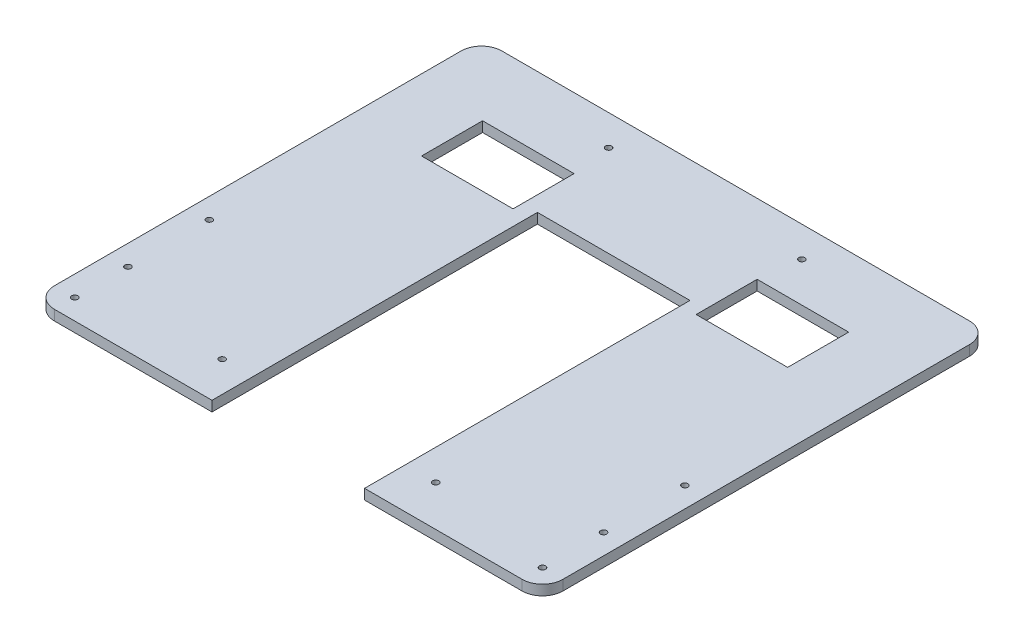
from build123d import *

# Parameters (mm, degrees)
EXTRUDE_1_DEPTH      = 5
SKETCH_4_W           = 45
SKETCH_4_H           = 30
CUT_EXTRUDE_3_DEPTH  = 5
SKETCH_5_W           = 75
SKETCH_5_H           = 160
CUT_EXTRUDE_4_DEPTH  = 5
CUT_EXTRUDE_5_REACH  = 335.054
SKETCH_6_R           = 1.5
CUT_EXTRUDE_9_REACH  = 335.054
SKETCH_9_R           = 1.5
SKETCH_11_R          = 1.5
CUT_EXTRUDE_10_DEPTH = 5


with BuildPart() as part:
    # 草图1 → 凸台-拉伸1 (new body)
    with BuildSketch(Plane(origin=(0, 0, 0), x_dir=(1, 0, 0), z_dir=(0, 1, 0))):
        with BuildLine():
            Line((10, 0), (240, 0))
            ThreePointArc((240, 0), (247.071067812, -2.928932188), (250, -10))
            Line((250, -10), (250, -210))
            ThreePointArc((250, -210), (247.071067812, -217.071067812), (240, -220))
            Line((240, -220), (10, -220))
            ThreePointArc((10, -220), (2.928932188, -217.071067812), (0, -210))
            Line((0, -210), (0, -10))
            ThreePointArc((0, -10), (2.928932188, -2.928932188), (10, 0))
        make_face()
    extrude(amount=EXTRUDE_1_DEPTH)

    # 草图4 → 切除-拉伸3 (cut)
    with BuildSketch(Plane.XZ):
        with Locations((192.5, 49.475)):
            Rectangle(SKETCH_4_W, SKETCH_4_H)
        with Locations((57.5, 49.475)):
            Rectangle(SKETCH_4_W, SKETCH_4_H)
    extrude(amount=-CUT_EXTRUDE_3_DEPTH, mode=Mode.SUBTRACT)

    # 草图5 → 切除-拉伸4 (cut)
    with BuildSketch(Plane.XZ):
        with Locations((125, 140)):
            Rectangle(SKETCH_5_W, SKETCH_5_H)
    extrude(amount=-CUT_EXTRUDE_4_DEPTH, mode=Mode.SUBTRACT)

    # 草图6 → 切除-拉伸5 (cut, up to next)
    with BuildSketch(Plane.XZ, mode=Mode.PRIVATE) as cut_extrude_5_sk1:
        with Locations(Location((72.5, 200, 0), (0, 0, 270))):
            Circle(SKETCH_6_R)
    cut_extrude_5_tool1 = extrude(cut_extrude_5_sk1.sketch, amount=-CUT_EXTRUDE_5_REACH, mode=Mode.PRIVATE) & part.part
    # 草图6 → 切除-拉伸5 (cut, up to next)
    with BuildSketch(Plane.XZ, mode=Mode.PRIVATE) as cut_extrude_5_sk2:
        with Locations(Location((177.5, 200, 0), (0, 0, 90))):
            Circle(SKETCH_6_R)
    cut_extrude_5_tool2 = extrude(cut_extrude_5_sk2.sketch, amount=-CUT_EXTRUDE_5_REACH, mode=Mode.PRIVATE) & part.part
    add(cut_extrude_5_tool1.solids().sort_by_distance((72.5, 0, 200))[0], mode=Mode.SUBTRACT)
    add(cut_extrude_5_tool2.solids().sort_by_distance((177.5, 0, 200))[0], mode=Mode.SUBTRACT)

    # 草图9 → 切除-拉伸9 (cut, up to next)
    with BuildSketch(Plane.XZ, mode=Mode.PRIVATE) as cut_extrude_9_sk1:
        with Locations(Location((77.5, 15, 0), (0, 0, 270))):
            Circle(SKETCH_9_R)
    cut_extrude_9_tool1 = extrude(cut_extrude_9_sk1.sketch, amount=-CUT_EXTRUDE_9_REACH, mode=Mode.PRIVATE) & part.part
    # 草图9 → 切除-拉伸9 (cut, up to next)
    with BuildSketch(Plane.XZ, mode=Mode.PRIVATE) as cut_extrude_9_sk2:
        with Locations(Location((10, 210, 0), (0, 0, 270))):
            Circle(SKETCH_9_R)
    cut_extrude_9_tool2 = extrude(cut_extrude_9_sk2.sketch, amount=-CUT_EXTRUDE_9_REACH, mode=Mode.PRIVATE) & part.part
    # 草图9 → 切除-拉伸9 (cut, up to next)
    with BuildSketch(Plane.XZ, mode=Mode.PRIVATE) as cut_extrude_9_sk3:
        with Locations(Location((240, 210, 0), (0, 0, 90))):
            Circle(SKETCH_9_R)
    cut_extrude_9_tool3 = extrude(cut_extrude_9_sk3.sketch, amount=-CUT_EXTRUDE_9_REACH, mode=Mode.PRIVATE) & part.part
    # 草图9 → 切除-拉伸9 (cut, up to next)
    with BuildSketch(Plane.XZ, mode=Mode.PRIVATE) as cut_extrude_9_sk4:
        with Locations(Location((172.5, 15, 0), (0, 0, 90))):
            Circle(SKETCH_9_R)
    cut_extrude_9_tool4 = extrude(cut_extrude_9_sk4.sketch, amount=-CUT_EXTRUDE_9_REACH, mode=Mode.PRIVATE) & part.part
    add(cut_extrude_9_tool1.solids().sort_by_distance((77.5, 0, 15))[0], mode=Mode.SUBTRACT)
    add(cut_extrude_9_tool2.solids().sort_by_distance((10, 0, 210))[0], mode=Mode.SUBTRACT)
    add(cut_extrude_9_tool3.solids().sort_by_distance((240, 0, 210))[0], mode=Mode.SUBTRACT)
    add(cut_extrude_9_tool4.solids().sort_by_distance((172.5, 0, 15))[0], mode=Mode.SUBTRACT)

    # 草图11 → 切除-拉伸10 (cut)
    with BuildSketch(Plane.XZ):
        with Locations(Location((240, 180, 0), (0, 0, 270))):
            Circle(SKETCH_11_R)
        with Locations(Location((240, 140, 0), (0, 0, 270))):
            Circle(SKETCH_11_R)
        with Locations(Location((10, 143.83552588, 0), (0, 0, 270))):
            Circle(SKETCH_11_R)
        with Locations(Location((10, 183.83552588, 0), (0, 0, 270))):
            Circle(SKETCH_11_R)
    extrude(amount=-CUT_EXTRUDE_10_DEPTH, mode=Mode.SUBTRACT)


solid = part.part
